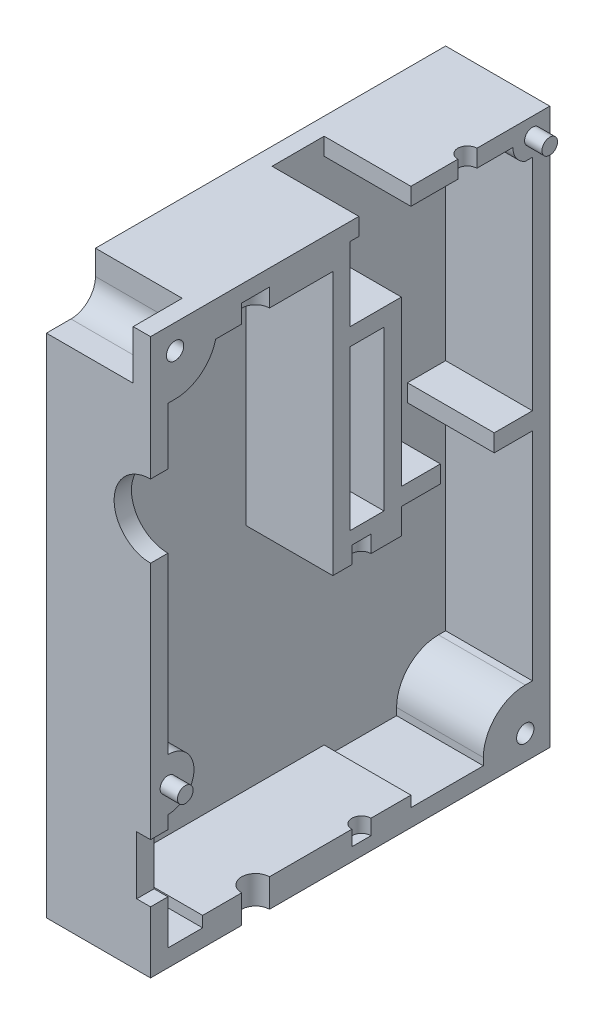
from build123d import *

# Parameters (mm, degrees)
SKETCH_1_W           = 46
SKETCH_1_H           = 64
EXTRUDE_1_DEPTH      = 12
SHELL_1_T            = -2
SKETCH_3_W           = 4.4
SKETCH_3_H           = 2
SKETCH_3_W_2         = 3.9
SKETCH_3_H_2         = 18.35
EXTRUDE_6_DEPTH      = 10
SKETCH_4_R           = 1
CUT_EXTRUDE_1_DEPTH  = 10
CUT_EXTRUDE_3_REACH  = 43.195
SKETCH_7_R           = 1
EXTRUDE_START        = -12
SKETCH_8_R           = 0.9
EXTRUDE_7_DEPTH      = 2
SKETCH_13_W          = 24
SKETCH_13_H          = 1.25
EXTRUDE_8_DEPTH      = 12
CUT_EXTRUDE_4_REACH  = 71.433
CUT_EXTRUDE_5_REACH  = 71.433
CUT_EXTRUDE_START    = -4
CUT_EXTRUDE_6_DEPTH  = 2.1
CUT_EXTRUDE_START_2  = -1.5
CUT_EXTRUDE_7_DEPTH  = 30.1
CUT_EXTRUDE_8_REACH  = 59.758
CUT_EXTRUDE_9_REACH  = 71.433
SKETCH_15_W          = 10
SKETCH_15_H          = 6
CUT_EXTRUDE_10_REACH = 59.758
SKETCH_16_W          = 1.6
SKETCH_16_H          = 6.7


with BuildPart() as part:
    # 草图1 → 凸台-拉伸1 (new body)
    with BuildSketch(Plane(origin=(0, 0, 0), x_dir=(0, 0, -1), z_dir=(1, 0, 0))):
        Rectangle(SKETCH_1_W, SKETCH_1_H)
    extrude(amount=EXTRUDE_1_DEPTH)

    # 抽壳1
    shell_1_openings = [part.faces().sort_by_distance(p)[0] for p in [
        (12, 0, 0),
    ]]
    offset(amount=SHELL_1_T, openings=shell_1_openings, kind=Kind.INTERSECTION)

    # 草图3 → 凸台-拉伸6 (add)
    # profile 1 of 5: a face of its own
    with BuildSketch(Plane(origin=(2, 0, 0), x_dir=(0, 0, -1), z_dir=(1, 0, 0))):
        with BuildLine():
            Line((20.175, -24.35), (21, -24.35))
            Line((21, -24.35), (21, -30))
            Line((21, -30), (15.35, -30))
            Line((15.35, -30), (15.35, -29.175))
            ThreePointArc((15.35, -29.175), (16.763209781, -25.763209781), (20.175, -24.35))
        make_face()
    # profile 2 of 5: a face of its own
    with BuildSketch(Plane(origin=(2, 0, 0), x_dir=(0, 0, -1), z_dir=(1, 0, 0))):
        with Locations((18.8, 1.6)):
            Rectangle(SKETCH_3_W, SKETCH_3_H)
    # profile 3 of 5: a face of its own
    with BuildSketch(Plane(origin=(2, 0, 0), x_dir=(0, 0, -1), z_dir=(1, 0, 0))):
        with BuildLine():
            Line((-21, 30), (-21, 24.35))
            Line((-21, 24.35), (-20.175, 24.35))
            ThreePointArc((-20.175, 24.35), (-17.207572663, 25.370397524), (-15.495256417, 28))
            Line((-15.495256417, 28), (-2, 28))
            Line((-2, 28), (-2, -2.35))
            Line((-2, -2.35), (5.9, -2.35))
            Line((5.9, -2.35), (5.9, 0.6))
            Line((5.9, 0.6), (10.4, 0.6))
            Line((10.4, 0.6), (10.4, 2.6))
            Line((10.4, 2.6), (5.9, 2.6))
            Line((5.9, 2.6), (5.9, 21.5))
            Line((5.9, 21.5), (0, 21.5))
            Line((0, 21.5), (0, 30))
            Line((0, 30), (-21, 30))
        make_face()
        with Locations((1.95, 10.325)):
            Rectangle(SKETCH_3_W_2, SKETCH_3_H_2, mode=Mode.SUBTRACT)
    # profile 4 of 5: a face of its own
    with BuildSketch(Plane(origin=(2, 0, 0), x_dir=(0, 0, -1), z_dir=(1, 0, 0))):
        with BuildLine():
            Line((-21, -10.7), (-21, -16.7))
            ThreePointArc((-21, -16.7), (-18, -13.7), (-21, -10.7))
        make_face()
    # profile 5 of 5: a face of its own
    with BuildSketch(Plane(origin=(2, 0, 0), x_dir=(0, 0, -1), z_dir=(1, 0, 0))):
        with BuildLine():
            Line((18.75, 30), (21, 30))
            Line((21, 30), (21, 27.9))
            Line((21, 27.9), (20.192225279, 27.9))
            ThreePointArc((20.192225279, 27.9), (19.145277228, 28.72622473), (18.75, 30))
        make_face()
    extrude(amount=EXTRUDE_6_DEPTH)

    # 草图4 → 切除-拉伸1 (cut)
    # profile 1 of 2: a face of its own
    with BuildSketch(Plane.ZY):
        with BuildLine():
            Line((-20.175, -26.35), (-23, -26.35))
            Line((-23, -26.35), (-23, -32))
            Line((-23, -32), (-17.382192318, -32))
            Line((-17.382192318, -32), (-17.35, -32))
            Line((-17.35, -32), (-17.35, -29.175))
            ThreePointArc((-17.35, -29.175), (-18.177423343, -27.177423343), (-20.175, -26.35))
        make_face()
        with Locations((-20.175, -29.175)):
            Circle(SKETCH_4_R, mode=Mode.SUBTRACT)
    # profile 2 of 2: a face of its own
    with BuildSketch(Plane.ZY):
        with BuildLine():
            Line((20.175, 26.35), (23, 26.35))
            Line((23, 26.35), (23, 32))
            Line((23, 32), (17.35, 32))
            Line((17.35, 32), (17.35, 29.175))
            ThreePointArc((17.35, 29.175), (18.177423343, 27.177423343), (20.175, 26.35))
        make_face()
        with Locations((20.175, 29.175)):
            Circle(SKETCH_4_R, mode=Mode.SUBTRACT)
    extrude(amount=-CUT_EXTRUDE_1_DEPTH, mode=Mode.SUBTRACT)

    # 草图7 → 切除-拉伸3 (cut, up to next)
    with BuildSketch(Plane.ZY, mode=Mode.PRIVATE) as cut_extrude_3_sk1:
        with Locations((-20.175, -29.175)):
            Circle(SKETCH_7_R)
    cut_extrude_3_tool1 = extrude(cut_extrude_3_sk1.sketch, amount=-CUT_EXTRUDE_3_REACH, mode=Mode.PRIVATE) & part.part
    # 草图7 → 切除-拉伸3 (cut, up to next)
    with BuildSketch(Plane.ZY, mode=Mode.PRIVATE) as cut_extrude_3_sk2:
        with Locations((20.175, 29.175)):
            Circle(SKETCH_7_R)
    cut_extrude_3_tool2 = extrude(cut_extrude_3_sk2.sketch, amount=-CUT_EXTRUDE_3_REACH, mode=Mode.PRIVATE) & part.part
    add(cut_extrude_3_tool1.solids().sort_by_distance((0, -29.175, -20.175))[0], mode=Mode.SUBTRACT)
    add(cut_extrude_3_tool2.solids().sort_by_distance((0, 29.175, 20.175))[0], mode=Mode.SUBTRACT)

    # 草图8 → 凸台-拉伸7 (add)
    with BuildSketch(Plane.ZY.offset(EXTRUDE_START)):
        with Locations(Location((-21, 30, 0), (0, 0, 180))):
            Circle(SKETCH_8_R)
        with Locations(Location((21, -13.7, 0), (0, 0, 180))):
            Circle(SKETCH_8_R)
    extrude(amount=-EXTRUDE_7_DEPTH)

    # 草图13 → 凸台-拉伸8 (add)
    with BuildSketch(Plane.ZY):
        with Locations((5, -29.375)):
            Rectangle(SKETCH_13_W, SKETCH_13_H)
    extrude(amount=-EXTRUDE_8_DEPTH)

    # 草图9 → 切除-拉伸4 (cut, up to next)
    with BuildSketch(Plane.XZ.offset(32), mode=Mode.PRIVATE) as cut_extrude_4_sk1:
        with BuildLine():
            Line((12, 9.3), (12, 12.5))
            ThreePointArc((12, 12.5), (10.4, 10.9), (12, 9.3))
        make_face()
    cut_extrude_4_tool1 = extrude(cut_extrude_4_sk1.sketch, amount=-CUT_EXTRUDE_4_REACH, mode=Mode.PRIVATE) & part.part
    add(cut_extrude_4_tool1.solids().sort_by_distance((11.320939, -32, 10.9))[0], mode=Mode.SUBTRACT)

    # 草图11 → 切除-拉伸5 (cut, up to next)
    with BuildSketch(Plane(origin=(0, 32, 0), x_dir=(1, 0, 0), z_dir=(0, 1, 0)), mode=Mode.PRIVATE) as cut_extrude_5_sk1:
        with BuildLine():
            Line((12, 12.4), (12, 14.6))
            ThreePointArc((12, 14.6), (10.9, 13.5), (12, 12.4))
        make_face()
    cut_extrude_5_tool1 = extrude(cut_extrude_5_sk1.sketch, amount=-CUT_EXTRUDE_5_REACH, mode=Mode.PRIVATE) & part.part
    add(cut_extrude_5_tool1.solids().sort_by_distance((11.533146, 32, -13.5))[0], mode=Mode.SUBTRACT)

    # 草图12 → 切除-拉伸6 (cut)
    with BuildSketch(Plane(origin=(0, 32, 0), x_dir=(1, 0, 0), z_dir=(0, 1, 0)).offset(CUT_EXTRUDE_START)):
        with BuildLine():
            Line((12, -12.5), (12, -9.3))
            ThreePointArc((12, -9.3), (10.4, -10.9), (12, -12.5))
        make_face()
    extrude(amount=CUT_EXTRUDE_6_DEPTH, mode=Mode.SUBTRACT)

    # 草图10 → 切除-拉伸7 (cut)
    with BuildSketch(Plane.XZ.offset(32).offset(CUT_EXTRUDE_START_2)):
        with BuildLine():
            Line((12, -2.4), (12, -0.2))
            ThreePointArc((12, -0.2), (10.9, -1.3), (12, -2.4))
        make_face()
    extrude(amount=-CUT_EXTRUDE_7_DEPTH, mode=Mode.SUBTRACT)

    # 草图14 → 切除-拉伸8 (cut, up to next)
    with BuildSketch(Plane.XY.offset(23), mode=Mode.PRIVATE) as cut_extrude_8_sk1:
        with BuildLine():
            Line((12, 17.79), (12, 9.39))
            ThreePointArc((12, 9.39), (7.8, 13.59), (12, 17.79))
        make_face()
    cut_extrude_8_tool1 = extrude(cut_extrude_8_sk1.sketch, amount=-CUT_EXTRUDE_8_REACH, mode=Mode.PRIVATE) & part.part
    add(cut_extrude_8_tool1.solids().sort_by_distance((10.217465, 13.59, 23))[0], mode=Mode.SUBTRACT)

    # 草图15 → 电机线切除-拉伸9 (cut, up to next)
    with BuildSketch(Plane(origin=(0, 32, 0), x_dir=(1, 0, 0), z_dir=(0, 1, 0)), mode=Mode.PRIVATE) as cut_extrude_9_sk1:
        with Locations((7, 4)):
            Rectangle(SKETCH_15_W, SKETCH_15_H)
    cut_extrude_9_tool1 = extrude(cut_extrude_9_sk1.sketch, amount=-CUT_EXTRUDE_9_REACH, mode=Mode.PRIVATE) & part.part
    add(cut_extrude_9_tool1.solids().sort_by_distance((7, 32, -4))[0], mode=Mode.SUBTRACT)

    # 草图16 → 拨杆切除-拉伸10 (cut, up to next)
    with BuildSketch(Plane.XY.offset(23), mode=Mode.PRIVATE) as cut_extrude_10_sk1:
        with Locations((11.2, -21.55)):
            Rectangle(SKETCH_16_W, SKETCH_16_H)
    cut_extrude_10_tool1 = extrude(cut_extrude_10_sk1.sketch, amount=-CUT_EXTRUDE_10_REACH, mode=Mode.PRIVATE) & part.part
    add(cut_extrude_10_tool1.solids().sort_by_distance((11.2, -21.55, 23))[0], mode=Mode.SUBTRACT)


solid = part.part
